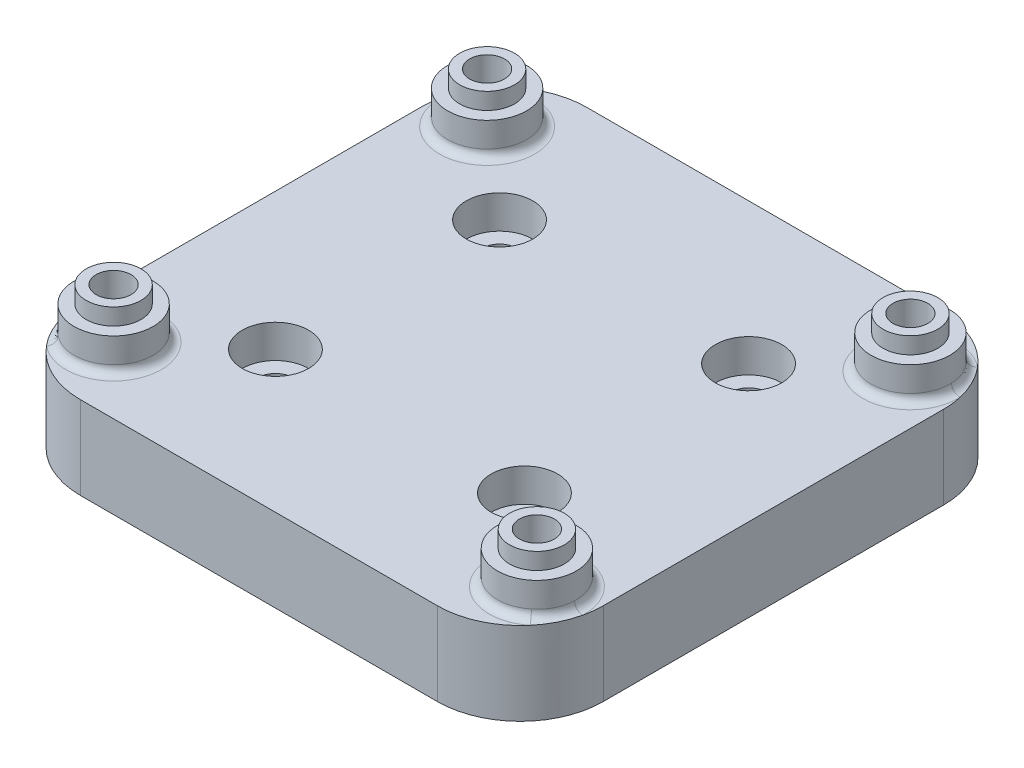
from build123d import *

# Parameters (mm, degrees)
ESQUISSE1_W             = 63
ESQUISSE1_H             = 61
BOSS_EXTRU_1_DEPTH      = 10
ESQUISSE4_R             = 4.75
BOSS_EXTRU_3_DEPTH      = 4
ESQUISSE5_R             = 3.3
BOSS_EXTRU_4_DEPTH      = 2
ESQUISSE6_R             = 2.1
ENL_V_MAT_EXTRU_2_DEPTH = 90.140338792
CONG_1_R                = 10
CONG_2_R                = 1
ESQUISSE7_R             = 2.1
ENL_V_MAT_EXTRU_3_DEPTH = 90.140338931
ESQUISSE8_R             = 4
ENL_V_MAT_EXTRU_4_DEPTH = 4
ESQUISSE9_R             = 4
ENL_V_MAT_EXTRU_5_DEPTH = 4.5


with BuildPart() as part:
    # Esquisse1 → Boss.-Extru.1 (new body)
    with BuildSketch(Plane(origin=(0, 0, 0), x_dir=(1, 0, 0), z_dir=(0, 1, 0))):
        with Locations((31.5, 30.5)):
            Rectangle(ESQUISSE1_W, ESQUISSE1_H)
    extrude(amount=BOSS_EXTRU_1_DEPTH)

    # Esquisse4 → Boss.-Extru.3 (add)
    with BuildSketch(Plane(origin=(0, 10, 0), x_dir=(1, 0, 0), z_dir=(0, 1, 0))):
        with Locations(Location((6, 8, 0), (0, 0, 90))):
            Circle(ESQUISSE4_R)
        with Locations(Location((6, 53, 0), (0, 0, 90))):
            Circle(ESQUISSE4_R)
        with Locations(Location((57, 8, 0), (0, 0, 90))):
            Circle(ESQUISSE4_R)
        with Locations(Location((57, 53, 0), (0, 0, 90))):
            Circle(ESQUISSE4_R)
    extrude(amount=BOSS_EXTRU_3_DEPTH)

    # Esquisse5 → Boss.-Extru.4 (add)
    with BuildSketch(Plane(origin=(0, 14, 0), x_dir=(1, 0, 0), z_dir=(0, 1, 0))):
        with Locations(Location((57, 53, 0), (0, 0, 270))):
            Circle(ESQUISSE5_R)
        with Locations(Location((57, 8, 0), (0, 0, 270))):
            Circle(ESQUISSE5_R)
        with Locations(Location((6, 8, 0), (0, 0, 270))):
            Circle(ESQUISSE5_R)
        with Locations(Location((6, 53, 0), (0, 0, 270))):
            Circle(ESQUISSE5_R)
    extrude(amount=BOSS_EXTRU_4_DEPTH)

    # Esquisse6 → Enlèv. mat.-Extru.2 (cut, through all)
    with BuildSketch(Plane(origin=(0, 16, 0), x_dir=(1, 0, 0), z_dir=(0, 1, 0))):
        with Locations(Location((6, 8, 0), (0, 0, 270))):
            Circle(ESQUISSE6_R)
        with Locations(Location((6, 53, 0), (0, 0, 270))):
            Circle(ESQUISSE6_R)
        with Locations(Location((57, 53, 0), (0, 0, 270))):
            Circle(ESQUISSE6_R)
        with Locations(Location((57, 8, 0), (0, 0, 270))):
            Circle(ESQUISSE6_R)
    extrude(amount=-ENL_V_MAT_EXTRU_2_DEPTH, mode=Mode.SUBTRACT)

    # Congé1
    cong_1_edges = [part.edges().sort_by_distance(p)[0] for p in [
        (0, 5, -61),
        (63, 5, -61),
        (63, 5, 0),
        (0, 5, 0),
    ]]
    fillet(cong_1_edges, radius=CONG_1_R)

    # Congé2
    cong_2_edges = [part.edges().sort_by_distance(p)[0] for p in [
        (6, 10, -3.25),
        (6, 10, -48.25),
        (57, 10, -3.25),
        (57, 10, -48.25),
    ]]
    fillet(cong_2_edges, radius=CONG_2_R)

    # Esquisse7 → Enlèv. mat.-Extru.3 (cut, through all)
    with BuildSketch(Plane(origin=(0, 0, 0), x_dir=(-1, 0, 0), z_dir=(0, -1, 0))):
        with Locations(Location((-16.5, 17, 0), (0, 0, 90))):
            Circle(ESQUISSE7_R)
        with Locations(Location((-46.5, 17, 0), (0, 0, 90))):
            Circle(ESQUISSE7_R)
        with Locations(Location((-16.5, 44, 0), (0, 0, 90))):
            Circle(ESQUISSE7_R)
        with Locations(Location((-46.5, 44, 0), (0, 0, 90))):
            Circle(ESQUISSE7_R)
    extrude(amount=-ENL_V_MAT_EXTRU_3_DEPTH, mode=Mode.SUBTRACT)

    # Esquisse8 → Enlèv. mat.-Extru.4 (cut)
    with BuildSketch(Plane(origin=(0, 10, 0), x_dir=(1, 0, 0), z_dir=(0, 1, 0))):
        with Locations(Location((16.5, 44, 0), (0, 0, 270))):
            Circle(ESQUISSE8_R)
        with Locations(Location((46.5, 44, 0), (0, 0, 270))):
            Circle(ESQUISSE8_R)
        with Locations(Location((46.5, 17, 0), (0, 0, 270))):
            Circle(ESQUISSE8_R)
        with Locations(Location((16.5, 17, 0), (0, 0, 270))):
            Circle(ESQUISSE8_R)
    extrude(amount=-ENL_V_MAT_EXTRU_4_DEPTH, mode=Mode.SUBTRACT)

    # Esquisse9 → Enlèv. mat.-Extru.5 (cut)
    with BuildSketch(Plane(origin=(0, 0, 0), x_dir=(-1, 0, 0), z_dir=(0, -1, 0))):
        with Locations(Location((-57, 8, 0), (0, 0, 90))):
            Circle(ESQUISSE9_R)
        with Locations(Location((-57, 53, 0), (0, 0, 90))):
            Circle(ESQUISSE9_R)
        with Locations(Location((-6, 53, 0), (0, 0, 90))):
            Circle(ESQUISSE9_R)
        with Locations(Location((-6, 8, 0), (0, 0, 90))):
            Circle(ESQUISSE9_R)
    extrude(amount=-ENL_V_MAT_EXTRU_5_DEPTH, mode=Mode.SUBTRACT)


solid = part.part
